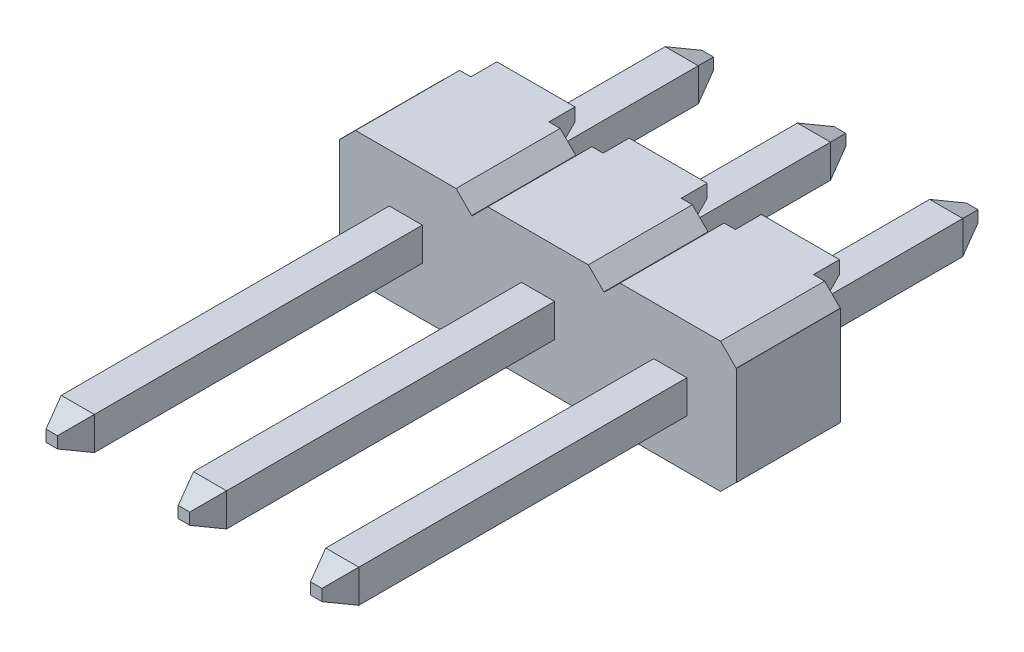
from build123d import *
from OCP.BRepFilletAPI import BRepFilletAPI_MakeChamfer

# Parameters (mm, degrees)
SKETCH1_W            = 7.62
SKETCH1_H            = 2.5
BOSS_EXTRUDE1_DEPTH  = 2
CUT_EXTRUDE1_DEPTH   = 9.265252567
SKETCH3_W            = 0.305
SKETCH3_H            = 0.3
CUT_EXTRUDE2_DEPTH   = 2
SKETCH4_W            = 0.305
SKETCH4_H            = 0.3
CUT_EXTRUDE3_DEPTH   = 9.265252567
CUT_EXTRUDE4_DEPTH   = 9.265252567
CUT_EXTRUDE5_DEPTH   = 9.265252567
SKETCH7_W            = 0.305
SKETCH7_H            = 0.3
CUT_EXTRUDE6_DEPTH   = 2
SKETCH8_W            = 0.305
SKETCH8_H            = 0.3
CUT_EXTRUDE7_DEPTH   = 9.265252567
CUT_EXTRUDE8_DEPTH   = 9.265252567
SKETCH10_W           = 0.635
SKETCH10_H           = 0.635
BOSS_EXTRUDE2_DEPTH  = 3.8
SKETCH11_W           = 0.635
SKETCH11_H           = 0.635
BOSS_EXTRUDE3_DEPTH  = 3.8
BOSS_EXTRUDE4_DEPTH  = 0.5
BOSS_EXTRUDE5_DEPTH  = 0.5
BOSS_EXTRUDE6_DEPTH  = 0.5
BOSS_EXTRUDE7_DEPTH  = 0.5
BOSS_EXTRUDE8_DEPTH  = 0.5
BOSS_EXTRUDE9_DEPTH  = 0.5
SKETCH18_W           = 0.635
SKETCH18_H           = 0.635
BOSS_EXTRUDE10_DEPTH = 3.8
SKETCH19_W           = 0.635
SKETCH19_H           = 0.635
BOSS_EXTRUDE11_DEPTH = 6.8
SKETCH20_W           = 0.635
SKETCH20_H           = 0.635
BOSS_EXTRUDE12_DEPTH = 6.8
SKETCH21_W           = 0.635
SKETCH21_H           = 0.635
BOSS_EXTRUDE13_DEPTH = 6.8
DRAFT1_ANGLE         = 45
DRAFT2_ANGLE         = 45
DRAFT3_ANGLE         = 45
DRAFT4_ANGLE         = 45
DRAFT5_ANGLE         = 45
CHAMFER1_SIZE        = 0.007071068
CHAMFER2_SIZE        = 0.207106781
CHAMFER2_SIZE2       = 0.5


with BuildPart() as part:
    # Sketch1 → Boss-Extrude1 (new body)
    with BuildSketch(Plane(origin=(0, 0, 0), x_dir=(-1, 0, 0), z_dir=(0, 0, -1))):
        with Locations((-3.81, 1.25)):
            Rectangle(SKETCH1_W, SKETCH1_H)
    extrude(amount=-BOSS_EXTRUDE1_DEPTH)

    # Sketch2 → Cut-Extrude1 (cut, through all)
    with BuildSketch(Plane.XY.offset(2)):
        Polygon((4.775, 2.5), (5.385, 1.89), (5.385, 2.5), align=None)
    extrude(amount=-CUT_EXTRUDE1_DEPTH, mode=Mode.SUBTRACT)

    # Sketch3 → Cut-Extrude2 (cut)
    with BuildSketch(Plane.XY.offset(2)):
        with Locations((7.4675, 2.35)):
            Rectangle(SKETCH3_W, SKETCH3_H)
    extrude(amount=-CUT_EXTRUDE2_DEPTH, mode=Mode.SUBTRACT)

    # Sketch4 → Cut-Extrude3 (cut, through all)
    with BuildSketch(Plane.XY.offset(2)):
        with Locations((7.4675, 0.15)):
            Rectangle(SKETCH4_W, SKETCH4_H)
    extrude(amount=-CUT_EXTRUDE3_DEPTH, mode=Mode.SUBTRACT)

    # Sketch5 → Cut-Extrude4 (cut, through all)
    with BuildSketch(Plane.XY.offset(2)):
        Polygon((5.385, 0), (5.385, 0.61), (4.775, 0), align=None)
    extrude(amount=-CUT_EXTRUDE4_DEPTH, mode=Mode.SUBTRACT)

    # Sketch6 → Cut-Extrude5 (cut, through all)
    with BuildSketch(Plane.XY.offset(2)):
        Polygon((2.845, 0), (2.235, 0.61), (2.235, 0), align=None)
    extrude(amount=-CUT_EXTRUDE5_DEPTH, mode=Mode.SUBTRACT)

    # Sketch7 → Cut-Extrude6 (cut)
    with BuildSketch(Plane.XY.offset(2)):
        with Locations((0.1525, 0.15)):
            Rectangle(SKETCH7_W, SKETCH7_H)
    extrude(amount=-CUT_EXTRUDE6_DEPTH, mode=Mode.SUBTRACT)

    # Sketch8 → Cut-Extrude7 (cut, through all)
    with BuildSketch(Plane.XY.offset(2)):
        with Locations((0.1525, 2.35)):
            Rectangle(SKETCH8_W, SKETCH8_H)
    extrude(amount=-CUT_EXTRUDE7_DEPTH, mode=Mode.SUBTRACT)

    # Sketch9 → Cut-Extrude8 (cut, through all)
    with BuildSketch(Plane.XY.offset(2)):
        Polygon((2.235, 2.5), (2.235, 1.89), (2.845, 2.5), align=None)
    extrude(amount=-CUT_EXTRUDE8_DEPTH, mode=Mode.SUBTRACT)

    # Sketch10 → Boss-Extrude2 (add)
    with BuildSketch(Plane(origin=(0, 0, 0), x_dir=(-1, 0, 0), z_dir=(0, 0, -1))):
        with Locations((-6.35, 1.25)):
            Rectangle(SKETCH10_W, SKETCH10_H)
    extrude(amount=BOSS_EXTRUDE2_DEPTH)

    # Sketch11 → Boss-Extrude3 (add)
    with BuildSketch(Plane(origin=(0, 0, 0), x_dir=(-1, 0, 0), z_dir=(0, 0, -1))):
        with Locations((-3.81, 1.25)):
            Rectangle(SKETCH11_W, SKETCH11_H)
    extrude(amount=BOSS_EXTRUDE3_DEPTH)

    # Sketch12 → Boss-Extrude4 (add)
    with BuildSketch(Plane(origin=(0, 0, 0), x_dir=(-1, 0, 0), z_dir=(0, 0, -1))):
        with BuildLine():
            Line((-5.6, 0), (-7.1, 0))
            Line((-7.1, 0), (-7.1, 0.75))
            Line((-7.1, 0.75), (-5.6, 0.75))
            add(Edge.make_bspline(
                [(-5.6, 0), (-5.6, 0.25), (-5.6, 0.75)],
                knots=[0, 0, 1, 3, 3], degree=1))
        make_face()
    extrude(amount=BOSS_EXTRUDE4_DEPTH)

    # Sketch13 → Boss-Extrude5 (add)
    with BuildSketch(Plane(origin=(0, 0, 0), x_dir=(-1, 0, 0), z_dir=(0, 0, -1))):
        with BuildLine():
            Line((-3.06, 0), (-4.56, 0))
            Line((-4.56, 0), (-4.56, 0.75))
            Line((-4.56, 0.75), (-3.06, 0.75))
            add(Edge.make_bspline(
                [(-3.06, 0), (-3.06, 0.25), (-3.06, 0.75)],
                knots=[0, 0, 1, 3, 3], degree=1))
        make_face()
    extrude(amount=BOSS_EXTRUDE5_DEPTH)

    # Sketch14 → Boss-Extrude6 (add)
    with BuildSketch(Plane(origin=(0, 0, 0), x_dir=(-1, 0, 0), z_dir=(0, 0, -1))):
        with BuildLine():
            Line((-0.52, 0), (-2.02, 0))
            Line((-2.02, 0), (-2.02, 0.75))
            Line((-2.02, 0.75), (-0.52, 0.75))
            add(Edge.make_bspline(
                [(-0.52, 0), (-0.52, 0.25), (-0.52, 0.75)],
                knots=[0, 0, 1, 3, 3], degree=1))
        make_face()
    extrude(amount=BOSS_EXTRUDE6_DEPTH)

    # Sketch15 → Boss-Extrude7 (add)
    with BuildSketch(Plane(origin=(0, 0, 0), x_dir=(-1, 0, 0), z_dir=(0, 0, -1))):
        with BuildLine():
            Line((-5.6, 1.75), (-7.1, 1.75))
            add(Edge.make_bspline(
                [(-7.1, 2.5), (-7.1, 2.25), (-7.1, 1.75)],
                knots=[-2.2, -2.2, -1.2, 0.8, 0.8], degree=1))
            Line((-7.1, 2.5), (-5.6, 2.5))
            Line((-5.6, 2.5), (-5.6, 1.75))
        make_face()
    extrude(amount=BOSS_EXTRUDE7_DEPTH)

    # Sketch16 → Boss-Extrude8 (add)
    with BuildSketch(Plane(origin=(0, 0, 0), x_dir=(-1, 0, 0), z_dir=(0, 0, -1))):
        with BuildLine():
            Line((-3.06, 1.75), (-4.56, 1.75))
            add(Edge.make_bspline(
                [(-4.56, 2.5), (-4.56, 2.25), (-4.56, 1.75)],
                knots=[-2.2, -2.2, -1.2, 0.8, 0.8], degree=1))
            Line((-4.56, 2.5), (-3.06, 2.5))
            Line((-3.06, 2.5), (-3.06, 1.75))
        make_face()
    extrude(amount=BOSS_EXTRUDE8_DEPTH)

    # Sketch17 → Boss-Extrude9 (add)
    with BuildSketch(Plane(origin=(0, 0, 0), x_dir=(-1, 0, 0), z_dir=(0, 0, -1))):
        with BuildLine():
            Line((-0.52, 1.75), (-2.02, 1.75))
            add(Edge.make_bspline(
                [(-2.02, 2.5), (-2.02, 2.25), (-2.02, 1.75)],
                knots=[-2.2, -2.2, -1.2, 0.8, 0.8], degree=1))
            Line((-2.02, 2.5), (-0.52, 2.5))
            Line((-0.52, 2.5), (-0.52, 1.75))
        make_face()
    extrude(amount=BOSS_EXTRUDE9_DEPTH)

    # Sketch18 → Boss-Extrude10 (add)
    with BuildSketch(Plane(origin=(0, 0, 0), x_dir=(-1, 0, 0), z_dir=(0, 0, -1))):
        with Locations((-1.27, 1.25)):
            Rectangle(SKETCH18_W, SKETCH18_H)
    extrude(amount=BOSS_EXTRUDE10_DEPTH)

    # Sketch19 → Boss-Extrude11 (add)
    with BuildSketch(Plane.XY.offset(2)):
        with Locations((6.35, 1.25)):
            Rectangle(SKETCH19_W, SKETCH19_H)
    extrude(amount=BOSS_EXTRUDE11_DEPTH)

    # Sketch20 → Boss-Extrude12 (add)
    with BuildSketch(Plane.XY.offset(2)):
        with Locations((3.81, 1.25)):
            Rectangle(SKETCH20_W, SKETCH20_H)
    extrude(amount=BOSS_EXTRUDE12_DEPTH)

    # Sketch21 → Boss-Extrude13 (add)
    with BuildSketch(Plane.XY.offset(2)):
        with Locations((1.27, 1.25)):
            Rectangle(SKETCH21_W, SKETCH21_H)
    extrude(amount=BOSS_EXTRUDE13_DEPTH)

    # Draft1
    draft1_faces = [part.faces().sort_by_distance(p)[0] for p in [
        (2.235, 2.195, 1),
        (0.305, 2.35, 1),
    ]]
    draft(draft1_faces, Plane(origin=(0, 2.5, 2), x_dir=(0, 0, 1), z_dir=(0, 1, 0)), DRAFT1_ANGLE)

    # Draft2
    draft2_faces = [part.faces().sort_by_distance(p)[0] for p in [
        (7.315, 2.35, 1),
        (5.385, 2.195, 1),
    ]]
    draft(draft2_faces, Plane(origin=(0, 2.5, 2), x_dir=(0, 0, 1), z_dir=(0, 1, 0)), DRAFT2_ANGLE)

    # Draft3
    draft3_faces = [part.faces().sort_by_distance(p)[0] for p in [
        (5.385, 0.305, 1),
        (7.315, 0.15, 1),
    ]]
    draft(draft3_faces, Plane(origin=(7.62, 0, 2), x_dir=(0, 0, -1), z_dir=(0, -1, 0)), DRAFT3_ANGLE)

    # Draft4
    draft4_faces = [part.faces().sort_by_distance(p)[0] for p in [
        (0.305, 0.15, 1),
        (2.235, 0.305, 1),
    ]]
    draft(draft4_faces, Plane(origin=(7.62, 0, 2), x_dir=(0, 0, -1), z_dir=(0, -1, 0)), DRAFT4_ANGLE)

    # Draft5
    draft5_faces = [part.faces().sort_by_distance(p)[0] for p in [
        (1.27, 0.75, -0.25),
        (3.81, 0.75, -0.25),
        (6.35, 0.75, -0.25),
        (6.35, 1.75, -0.25),
        (3.81, 1.75, -0.25),
        (1.27, 1.75, -0.25),
    ]]
    draft(draft5_faces, Plane(origin=(0, 0, 0), x_dir=(-1, 0, 0), z_dir=(0, 0, -1)), DRAFT5_ANGLE)

    # Chamfer1
    chamfer1_edges = [part.edges().sort_by_distance(p)[0] for p in [
        (2.54, 0.305, 1),
        (2.54, 2.195, 1),
        (5.08, 2.195, 1),
        (5.08, 0.305, 1),
    ]]
    chamfer(chamfer1_edges, length=CHAMFER1_SIZE)

    # Chamfer2: one chamfer whose edges measure the first distance from different faces: ONE call of the kernel's chamfer builder (chamfer() names one face for all edges)
    chamfer2_edges_1 = [part.edges().sort_by_distance(p)[0] for p in [
        (1.5875, 1.25, 8.8),
        (1.27, 0.9325, 8.8),
        (1.27, 1.5675, 8.8),
        (0.9525, 1.25, 8.8),
    ]]
    chamfer2_side_1 = [part.faces().sort_by_distance(p)[0] for p in [
        (1.27, 1.25, 8.8),
    ]]
    chamfer2_edges_2 = [part.edges().sort_by_distance(p)[0] for p in [
        (6.6675, 1.25, 8.8),
        (6.35, 0.9325, 8.8),
        (6.35, 1.5675, 8.8),
        (6.0325, 1.25, 8.8),
    ]]
    chamfer2_side_2 = [part.faces().sort_by_distance(p)[0] for p in [
        (6.35, 1.25, 8.8),
    ]]
    chamfer2_edges_3 = [part.edges().sort_by_distance(p)[0] for p in [
        (3.81, 1.5675, -3.8),
        (4.1275, 1.25, -3.8),
        (3.4925, 1.25, -3.8),
        (3.81, 0.9325, -3.8),
    ]]
    chamfer2_side_3 = [part.faces().sort_by_distance(p)[0] for p in [
        (3.81, 1.25, -3.8),
    ]]
    chamfer2_edges_4 = [part.edges().sort_by_distance(p)[0] for p in [
        (1.27, 1.5675, -3.8),
        (1.5875, 1.25, -3.8),
        (0.9525, 1.25, -3.8),
        (1.27, 0.9325, -3.8),
    ]]
    chamfer2_side_4 = [part.faces().sort_by_distance(p)[0] for p in [
        (1.27, 1.25, -3.8),
    ]]
    chamfer2_edges_5 = [part.edges().sort_by_distance(p)[0] for p in [
        (6.0325, 1.25, -3.8),
        (6.35, 1.5675, -3.8),
        (6.35, 0.9325, -3.8),
        (6.6675, 1.25, -3.8),
    ]]
    chamfer2_side_5 = [part.faces().sort_by_distance(p)[0] for p in [
        (6.35, 1.25, -3.8),
    ]]
    chamfer2_edges_6 = [part.edges().sort_by_distance(p)[0] for p in [
        (4.1275, 1.25, 8.8),
        (3.81, 0.9325, 8.8),
        (3.81, 1.5675, 8.8),
        (3.4925, 1.25, 8.8),
    ]]
    chamfer2_side_6 = [part.faces().sort_by_distance(p)[0] for p in [
        (3.81, 1.25, 8.8),
    ]]
    chamfer2 = BRepFilletAPI_MakeChamfer(part.part.solid().wrapped)
    for e in chamfer2_edges_1:
        chamfer2.Add(CHAMFER2_SIZE, CHAMFER2_SIZE2, e.wrapped, chamfer2_side_1[0].wrapped)  # the first distance lies on this face
    for e in chamfer2_edges_2:
        chamfer2.Add(CHAMFER2_SIZE, CHAMFER2_SIZE2, e.wrapped, chamfer2_side_2[0].wrapped)  # the first distance lies on this face
    for e in chamfer2_edges_3:
        chamfer2.Add(CHAMFER2_SIZE, CHAMFER2_SIZE2, e.wrapped, chamfer2_side_3[0].wrapped)  # the first distance lies on this face
    for e in chamfer2_edges_4:
        chamfer2.Add(CHAMFER2_SIZE, CHAMFER2_SIZE2, e.wrapped, chamfer2_side_4[0].wrapped)  # the first distance lies on this face
    for e in chamfer2_edges_5:
        chamfer2.Add(CHAMFER2_SIZE, CHAMFER2_SIZE2, e.wrapped, chamfer2_side_5[0].wrapped)  # the first distance lies on this face
    for e in chamfer2_edges_6:
        chamfer2.Add(CHAMFER2_SIZE, CHAMFER2_SIZE2, e.wrapped, chamfer2_side_6[0].wrapped)  # the first distance lies on this face
    add(Compound.cast(chamfer2.Shape()), mode=Mode.REPLACE)


solid = part.part
